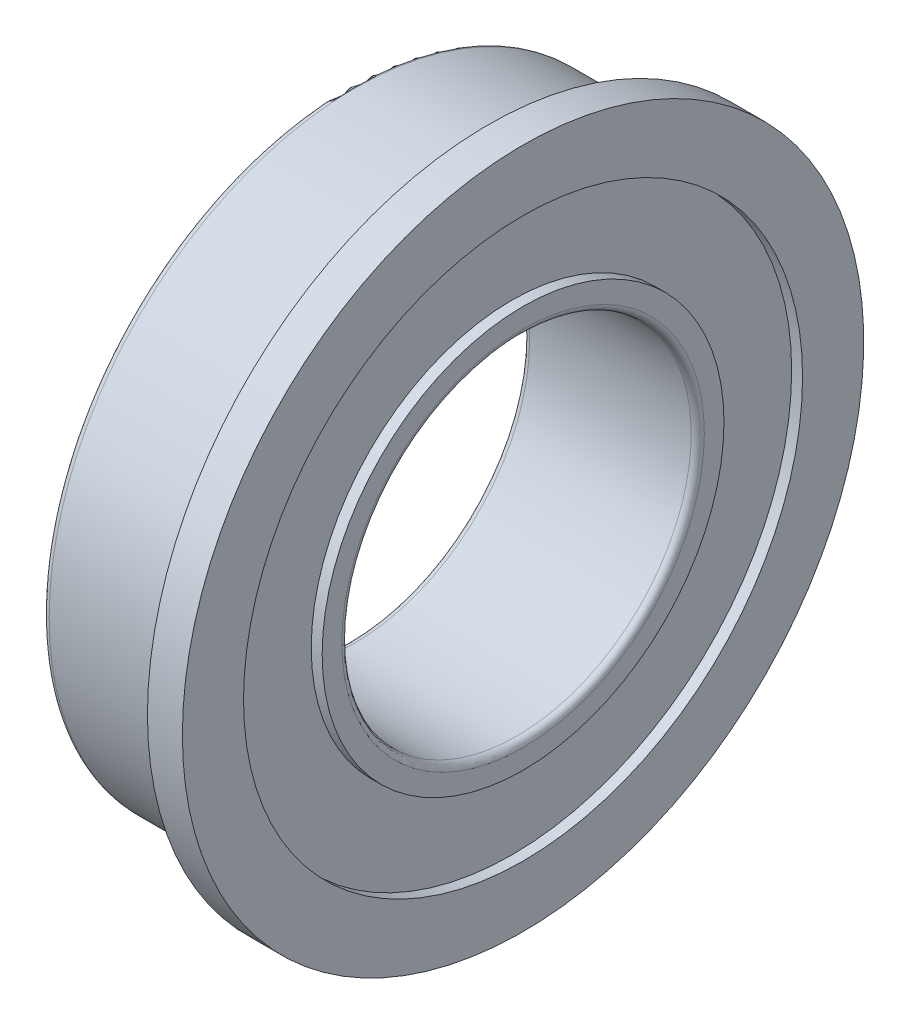
from build123d import *

# Parameters (mm, degrees)
FILLET1_R = 0.15


with BuildPart() as part:
    # Sketch1 → Revolve1 (revolve)
    with BuildSketch(Plane.XY, mode=Mode.PRIVATE) as revolve1_sk:
        with BuildLine():
            Line((0, 7.2), (0, 7.8))
            Line((0, 7.8), (0.8, 7.8))
            Line((0.8, 7.8), (0.8, 6.4))
            Line((0.8, 6.4), (0.55, 6.4))
            Line((0.55, 6.4), (0.55, 4.6))
            Line((0.55, 4.6), (0.8, 4.6))
            Line((0.8, 4.6), (0.8, 4))
            Line((0.8, 4), (-3.2, 4))
            Line((-3.2, 4), (-3.2, 4.6))
            Line((-3.2, 4.6), (-2.95, 4.6))
            Line((-2.95, 4.6), (-2.95, 6.4))
            Line((-2.95, 6.4), (-3.2, 6.4))
            Line((-3.2, 6.4), (-3.2, 7))
            Line((-3.2, 7), (-0.2, 7))
            ThreePointArc((-0.2, 7), (0.141421356, 6.858578644), (0, 7.2))
        make_face()
    revolve(revolve1_sk.sketch.rotate(Axis((-3.2, 0, 0), (1, 0, 0)), 90), axis=Axis((-3.2, 0, 0), (1, 0, 0)))

    # Fillet1
    fillet1_edges = [part.edges().sort_by_distance(p)[0] for p in [
        (0.8, 0, -4),
        (-3.2, 0, -4),
        (-3.2, 0, -7),
    ]]
    fillet(fillet1_edges, radius=FILLET1_R)


solid = part.part
